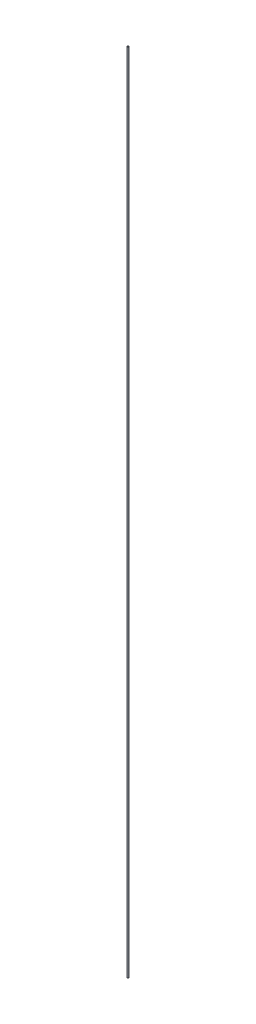
from build123d import *

# Parameters (mm, degrees)
SWEEP1_PROFILE_R = 6.35


with BuildPart() as part:
    # Sweep1: sweep along a path in Sketch1
    with BuildLine(Plane.XY) as sweep1_path:
        Line((0, 0), (0, 8215.884))
    # Sweep1 profile (on start of the path) → Sweep1 (sweep)
    with BuildSketch(Plane.ZX):
        Circle(SWEEP1_PROFILE_R)
    sweep(path=sweep1_path.line)


solid = part.part
